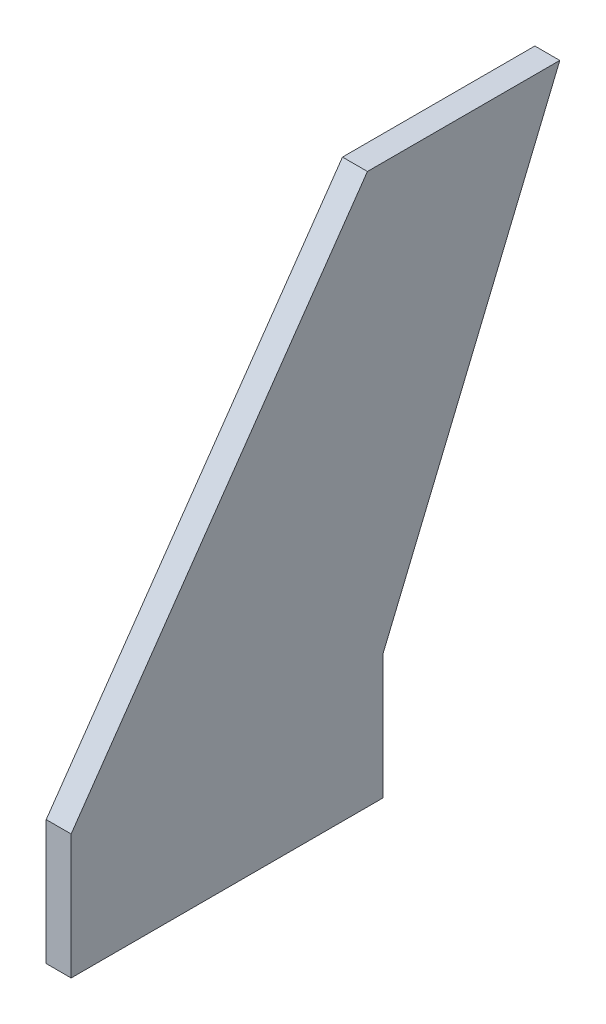
from build123d import *

# Parameters (mm, degrees)
SALIENTE_EXTRUIR1_DEPTH = 4


with BuildPart() as part:
    # Croquis1 → Saliente-Extruir1 (new body)
    with BuildSketch(Plane(origin=(0, 0, 0), x_dir=(0, 0, -1), z_dir=(1, 0, 0))):
        Polygon((31.77750931, 8.602977891), (79.291659343, 76.856040613), (110.141305144, 76.856040613), (81.77750931, 8.602977891), (81.77750931, -11.397022109), (31.77750931, -11.397022109), align=None)
    extrude(amount=SALIENTE_EXTRUIR1_DEPTH)


solid = part.part
